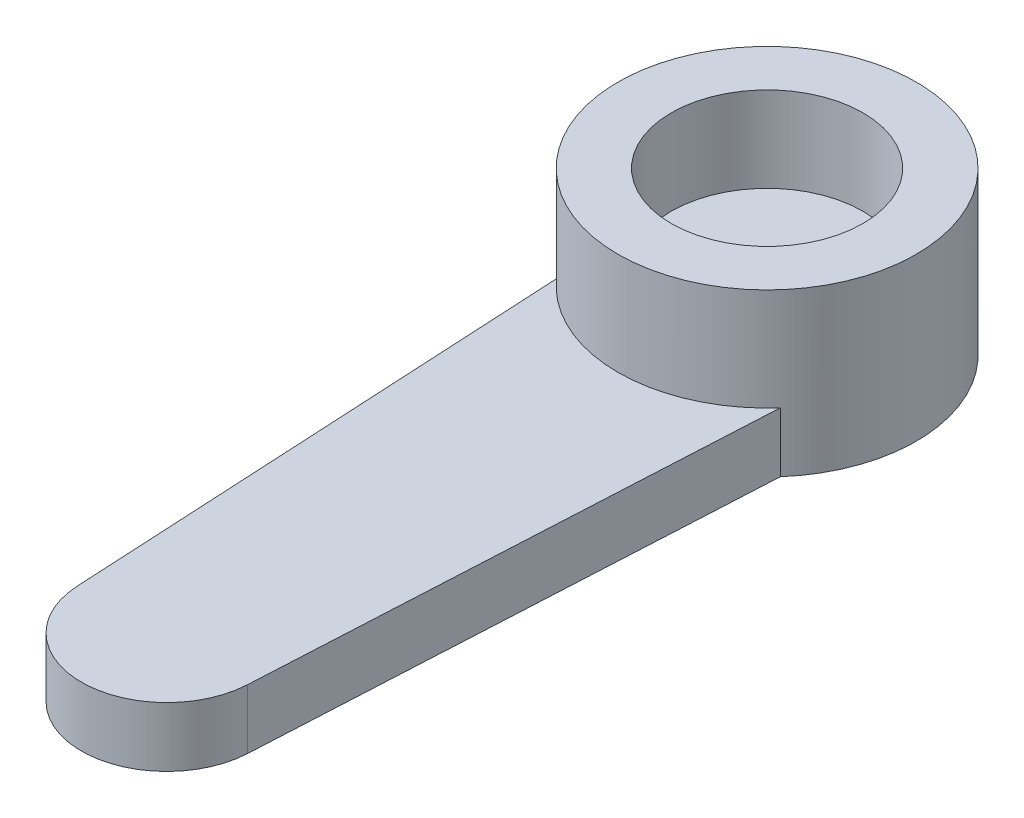
from build123d import *

# Parameters (mm, degrees)
SKETCH1_R           = 3.5
BOSS_EXTRUDE1_DEPTH = 3.8
BOSS_EXTRUDE2_DEPTH = 1.4
SKETCH3_R           = 2.25
CUT_EXTRUDE1_DEPTH  = 2


with BuildPart() as part:
    # Sketch1 → Boss-Extrude1 (new body)
    with BuildSketch(Plane(origin=(0, 0, 0), x_dir=(1, 0, 0), z_dir=(0, 1, 0))):
        with Locations(Location((0, 0, 0), (0, 0, 90))):
            Circle(SKETCH1_R)
    extrude(amount=BOSS_EXTRUDE1_DEPTH)

    # Sketch2 → Boss-Extrude2 (add)
    with BuildSketch(Plane.XZ):
        with BuildLine():
            Line((-2, 14.192474485), (-2.625, 2.315032397))
            ThreePointArc((-2.625, 2.315032397), (0, 3.5), (2.625, 2.315032397))
            Line((2.625, 2.315032397), (2, 14.192474485))
            ThreePointArc((2, 14.192474485), (0, 16.09), (-2, 14.192474485))
        make_face()
    extrude(amount=-BOSS_EXTRUDE2_DEPTH)

    # Sketch3 → Cut-Extrude1 (cut)
    with BuildSketch(Plane(origin=(0, 3.8, 0), x_dir=(1, 0, 0), z_dir=(0, 1, 0))):
        with Locations(Location((0, 0, 0), (0, 0, 270))):
            Circle(SKETCH3_R)
    extrude(amount=-CUT_EXTRUDE1_DEPTH, mode=Mode.SUBTRACT)


solid = part.part
